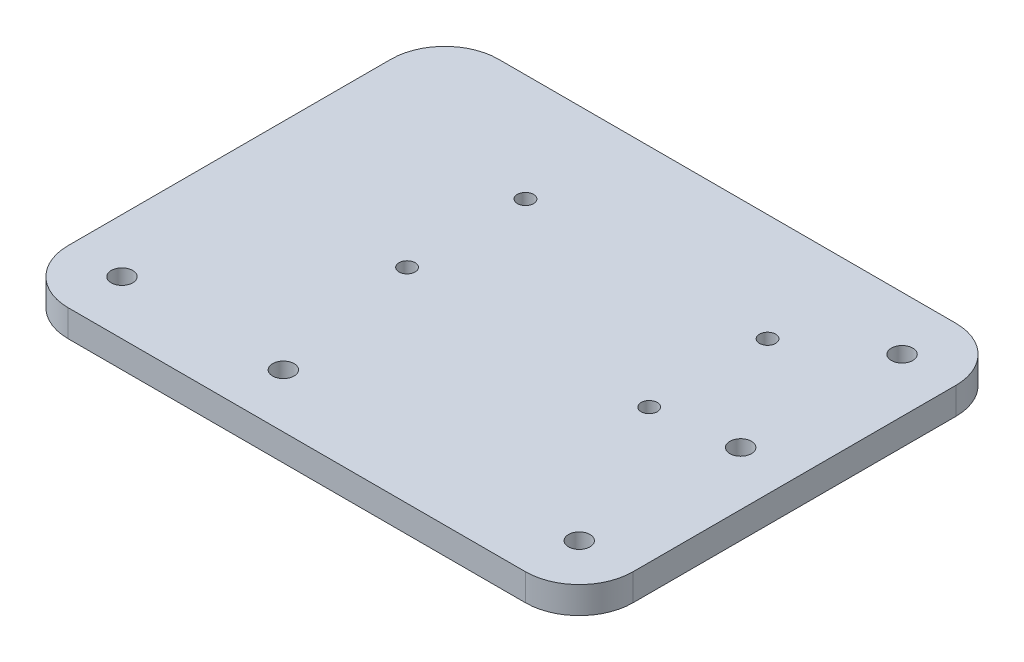
from build123d import *

# Parameters (mm, degrees)
SKETCH_1_W          = 105
SKETCH_1_H          = 80
EXTRUDE_1_DEPTH     = 5
SKETCH_2_R          = 1.5
CUT_EXTRUDE_1_DEPTH = 67.191011474
SKETCH_3_R          = 2
CUT_EXTRUDE_2_DEPTH = 5
FILLET_1_R          = 10


with BuildPart() as part:
    # 草图1 → 凸台-拉伸1 (new body)
    with BuildSketch(Plane(origin=(0, 0, 0), x_dir=(1, 0, 0), z_dir=(0, 1, 0))):
        Rectangle(SKETCH_1_W, SKETCH_1_H)
    extrude(amount=EXTRUDE_1_DEPTH)

    # 草图2 → 切除-拉伸1 (cut, through all)
    with BuildSketch(Plane(origin=(0, 5, 0), x_dir=(1, 0, 0), z_dir=(0, 1, 0))):
        with Locations(Location((-17.5, 20, 0), (0, 0, 270))):
            Circle(SKETCH_2_R)
        with Locations(Location((27.5, 20, 0), (0, 0, 270))):
            Circle(SKETCH_2_R)
        with Locations(Location((27.5, -2, 0), (0, 0, 270))):
            Circle(SKETCH_2_R)
        with Locations(Location((-17.5, -2, 0), (0, 0, 270))):
            Circle(SKETCH_2_R)
    extrude(amount=-CUT_EXTRUDE_1_DEPTH, mode=Mode.SUBTRACT)

    # 草图3 → 切除-拉伸2 (cut)
    with BuildSketch(Plane(origin=(0, 5, 0), x_dir=(1, 0, 0), z_dir=(0, 1, 0))):
        with Locations(Location((-12.5, -30, 0), (0, 0, 270))):
            Circle(SKETCH_3_R)
        with Locations(Location((-42.5, -30, 0), (0, 0, 270))):
            Circle(SKETCH_3_R)
        with Locations(Location((42.5, 0, 0), (0, 0, 270))):
            Circle(SKETCH_3_R)
        with Locations(Location((42.5, 30, 0), (0, 0, 270))):
            Circle(SKETCH_3_R)
        with Locations(Location((42.5, -30, 0), (0, 0, 270))):
            Circle(SKETCH_3_R)
    extrude(amount=-CUT_EXTRUDE_2_DEPTH, mode=Mode.SUBTRACT)

    # 圆角1
    fillet_1_edges = [part.edges().sort_by_distance(p)[0] for p in [
        (-52.5, 2.5, -40),
        (52.5, 2.5, -40),
        (52.5, 2.5, 40),
        (-52.5, 2.5, 40),
    ]]
    fillet(fillet_1_edges, radius=FILLET_1_R)


solid = part.part
